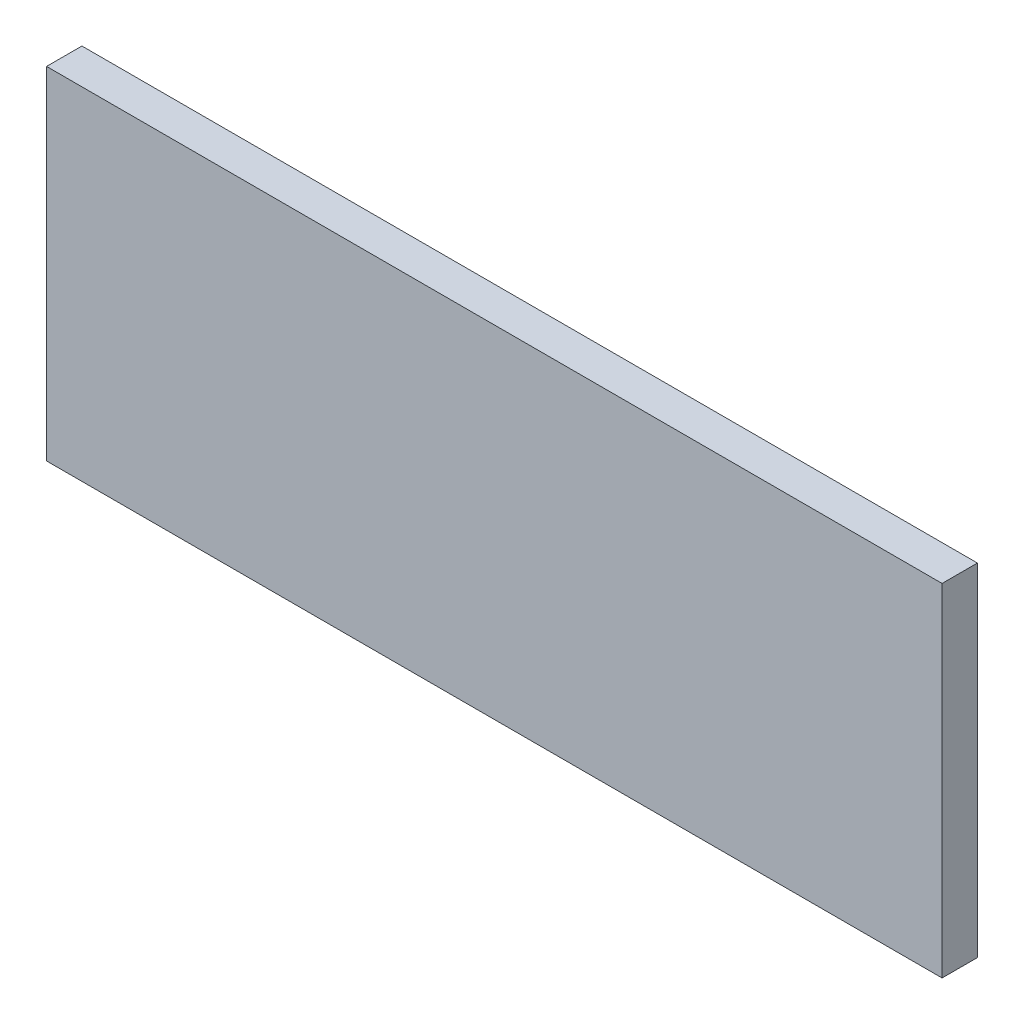
from build123d import *

# Parameters (mm, degrees)
SKETCH1_W           = 482.6
SKETCH1_H           = 184.15
BOSS_EXTRUDE1_DEPTH = 19.05


with BuildPart() as part:
    # Sketch1 → Boss-Extrude1 (new body)
    with BuildSketch(Plane.XY):
        with Locations((241.3, 92.075)):
            Rectangle(SKETCH1_W, SKETCH1_H)
    extrude(amount=BOSS_EXTRUDE1_DEPTH)


solid = part.part
